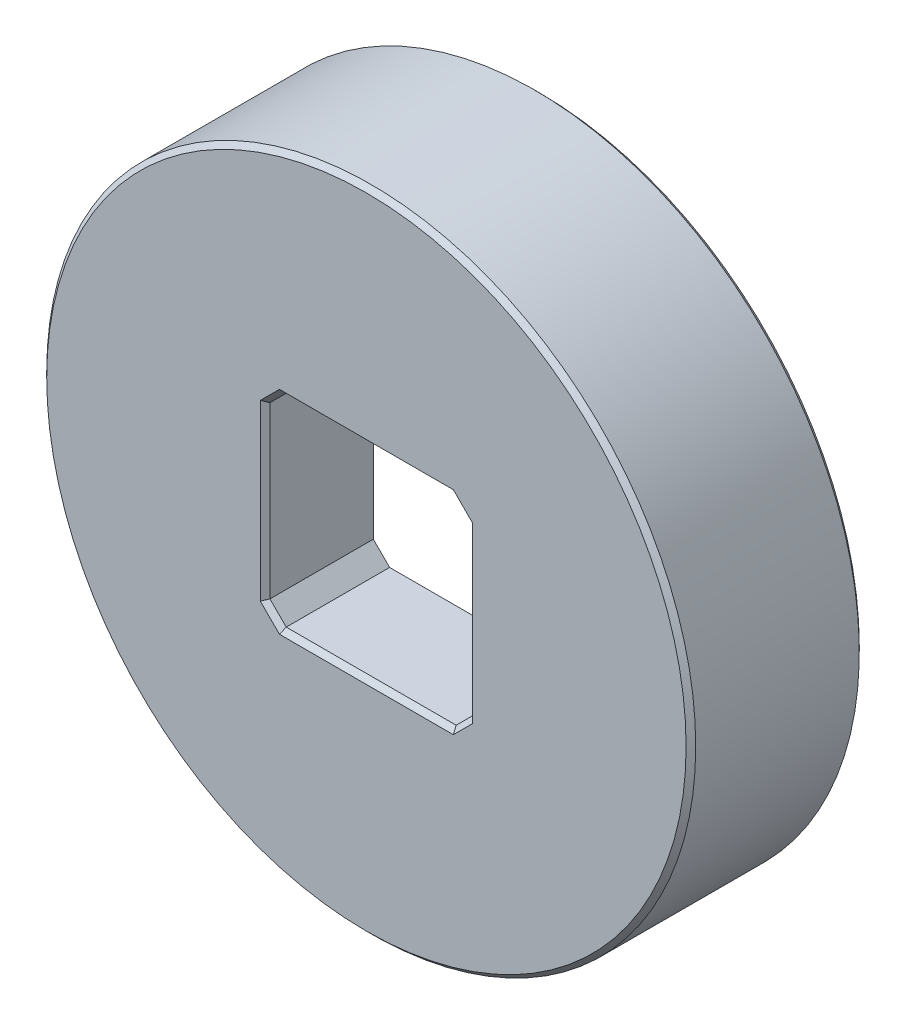
from build123d import *

# Parameters (mm, degrees)
SKETCH1_R           = 27
BOSS_EXTRUDE1_DEPTH = 2
BOSS_EXTRUDE2_START = 12.41
SKETCH2_R           = 27
SKETCH2_R_2         = 25
BOSS_EXTRUDE2_DEPTH = 12.41
BOSS_EXTRUDE3_START = -9
BOSS_EXTRUDE3_DEPTH = 9
CHAMFER1_SIZE       = 0.4


with BuildPart() as part:
    # Sketch1 → Boss-Extrude1 (new body)
    with BuildSketch(Plane.XY):
        Circle(SKETCH1_R)
        with BuildLine():
            Line((-9.232106781, -7.817893219), (-7.817893219, -9.232106781))
            ThreePointArc((-7.817893219, -9.232106781), (-7.49346987, -9.448879533), (-7.110786438, -9.525))
            Line((-7.110786438, -9.525), (7.110786438, -9.525))
            ThreePointArc((7.110786438, -9.525), (7.49346987, -9.448879533), (7.817893219, -9.232106781))
            Line((7.817893219, -9.232106781), (9.232106781, -7.817893219))
            ThreePointArc((9.232106781, -7.817893219), (9.448879533, -7.49346987), (9.525, -7.110786438))
            Line((9.525, -7.110786438), (9.525, 7.110786438))
            ThreePointArc((9.525, 7.110786438), (9.448879533, 7.49346987), (9.232106781, 7.817893219))
            Line((9.232106781, 7.817893219), (7.817893219, 9.232106781))
            ThreePointArc((7.817893219, 9.232106781), (7.49346987, 9.448879533), (7.110786438, 9.525))
            Line((7.110786438, 9.525), (-7.110786438, 9.525))
            ThreePointArc((-7.110786438, 9.525), (-7.49346987, 9.448879533), (-7.817893219, 9.232106781))
            Line((-7.817893219, 9.232106781), (-9.232106781, 7.817893219))
            ThreePointArc((-9.232106781, 7.817893219), (-9.448879533, 7.49346987), (-9.525, 7.110786438))
            Line((-9.525, 7.110786438), (-9.525, -7.110786438))
            ThreePointArc((-9.525, -7.110786438), (-9.448879533, -7.49346987), (-9.232106781, -7.817893219))
        make_face(mode=Mode.SUBTRACT)
    extrude(amount=BOSS_EXTRUDE1_DEPTH)

    # Sketch2 → Boss-Extrude2 (add)
    with BuildSketch(Plane(origin=(0, 0, 0), x_dir=(-1, 0, 0), z_dir=(0, 0, -1)).offset(BOSS_EXTRUDE2_START)):
        Circle(SKETCH2_R)
        with Locations(Location((0, 0, 0), (0, 0, 180))):
            Circle(SKETCH2_R_2, mode=Mode.SUBTRACT)
    extrude(amount=-BOSS_EXTRUDE2_DEPTH)

    # Sketch3 → Boss-Extrude3 (add)
    with BuildSketch(Plane.XY.offset(2).offset(BOSS_EXTRUDE3_START)):
        with BuildLine():
            Line((-7.110786438, -9.525), (7.110786438, -9.525))
            ThreePointArc((7.110786438, -9.525), (7.49346987, -9.448879533), (7.817893219, -9.232106781))
            Line((7.817893219, -9.232106781), (9.232106781, -7.817893219))
            ThreePointArc((9.232106781, -7.817893219), (9.448879533, -7.49346987), (9.525, -7.110786438))
            Line((9.525, -7.110786438), (9.525, 7.110786438))
            ThreePointArc((9.525, 7.110786438), (9.448879533, 7.49346987), (9.232106781, 7.817893219))
            Line((9.232106781, 7.817893219), (7.817893219, 9.232106781))
            ThreePointArc((7.817893219, 9.232106781), (7.49346987, 9.448879533), (7.110786438, 9.525))
            Line((7.110786438, 9.525), (-7.110786438, 9.525))
            ThreePointArc((-7.110786438, 9.525), (-7.49346987, 9.448879533), (-7.817893219, 9.232106781))
            Line((-7.817893219, 9.232106781), (-9.232106781, 7.817893219))
            ThreePointArc((-9.232106781, 7.817893219), (-9.448879533, 7.49346987), (-9.525, 7.110786438))
            Line((-9.525, 7.110786438), (-9.525, -7.110786438))
            ThreePointArc((-9.525, -7.110786438), (-9.448879533, -7.49346987), (-9.232106781, -7.817893219))
            Line((-9.232106781, -7.817893219), (-7.817893219, -9.232106781))
            ThreePointArc((-7.817893219, -9.232106781), (-7.49346987, -9.448879533), (-7.110786438, -9.525))
        make_face()
        Polygon((-7.069365081, -8.425), (7.069365081, -8.425), (8.425, -7.069365081), (8.425, 7.069365081), (7.069365081, 8.425), (-7.069365081, 8.425), (-8.425, 7.069365081), (-8.425, -7.069365081), align=None, mode=Mode.SUBTRACT)
    extrude(amount=BOSS_EXTRUDE3_DEPTH)

    # Chamfer1
    chamfer1_edges = [part.edges().sort_by_distance(p)[0] for p in [
        (-27, 0, 2),
        (-25, 0, 0),
        (27, 0, -12.41),
        (0, -9.525, -7),
        (7.49346987, -9.448879533, -7),
        (8.525, -8.525, -7),
        (9.448879533, -7.49346987, -7),
        (9.525, 0, -7),
        (9.448879533, 7.49346987, -7),
        (8.525, 8.525, -7),
        (7.49346987, 9.448879533, -7),
        (0, 9.525, -7),
        (-7.49346987, 9.448879533, -7),
        (-8.525, 8.525, -7),
        (-9.448879533, 7.49346987, -7),
        (-8.525, -8.525, -7),
        (-9.525, 0, -7),
        (-7.49346987, -9.448879533, -7),
        (-9.448879533, -7.49346987, -7),
        (-7.747182541, -7.747182541, 2),
        (-8.425, 0, 2),
        (-7.747182541, 7.747182541, 2),
        (0, 8.425, 2),
        (7.747182541, 7.747182541, 2),
        (8.425, 0, 2),
        (7.747182541, -7.747182541, 2),
        (0, -8.425, 2),
    ]]
    chamfer(chamfer1_edges, length=CHAMFER1_SIZE)


solid = part.part
